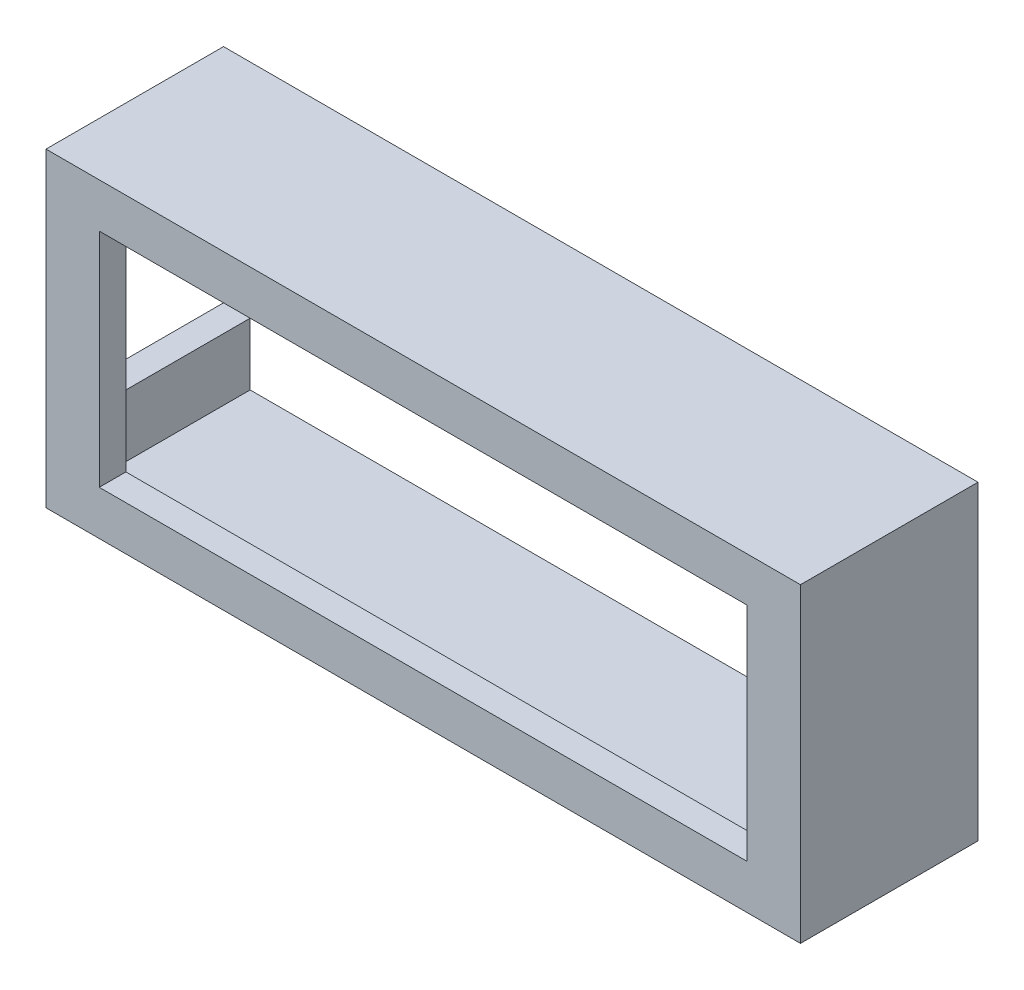
from build123d import *

# Parameters (mm, degrees)
SKETCH1_W           = 85
SKETCH1_H           = 35
BOSS_EXTRUDE1_DEPTH = 20
SHELL1_T            = -3
SKETCH3_W           = 17
SKETCH3_H           = 15
CUT_EXTRUDE1_DEPTH  = 20
SKETCH4_W           = 73
SKETCH4_H           = 25
CUT_EXTRUDE2_DEPTH  = 20


with BuildPart() as part:
    # Sketch1 → Boss-Extrude1 (new body)
    with BuildSketch(Plane.XY):
        Rectangle(SKETCH1_W, SKETCH1_H)
    extrude(amount=BOSS_EXTRUDE1_DEPTH)

    # Shell1
    shell1_openings = [part.faces().sort_by_distance(p)[0] for p in [
        (0, 0, 0),
    ]]
    offset(amount=SHELL1_T, openings=shell1_openings, kind=Kind.INTERSECTION)

    # Sketch3 → Cut-Extrude1 (cut)
    with BuildSketch(Plane.ZY.offset(42.5)):
        with Locations((8.5, 0)):
            Rectangle(SKETCH3_W, SKETCH3_H)
    extrude(amount=-CUT_EXTRUDE1_DEPTH, mode=Mode.SUBTRACT)

    # Sketch4 → Cut-Extrude2 (cut)
    with BuildSketch(Plane.XY.offset(20)):
        Rectangle(SKETCH4_W, SKETCH4_H)
    extrude(amount=-CUT_EXTRUDE2_DEPTH, mode=Mode.SUBTRACT)


solid = part.part
